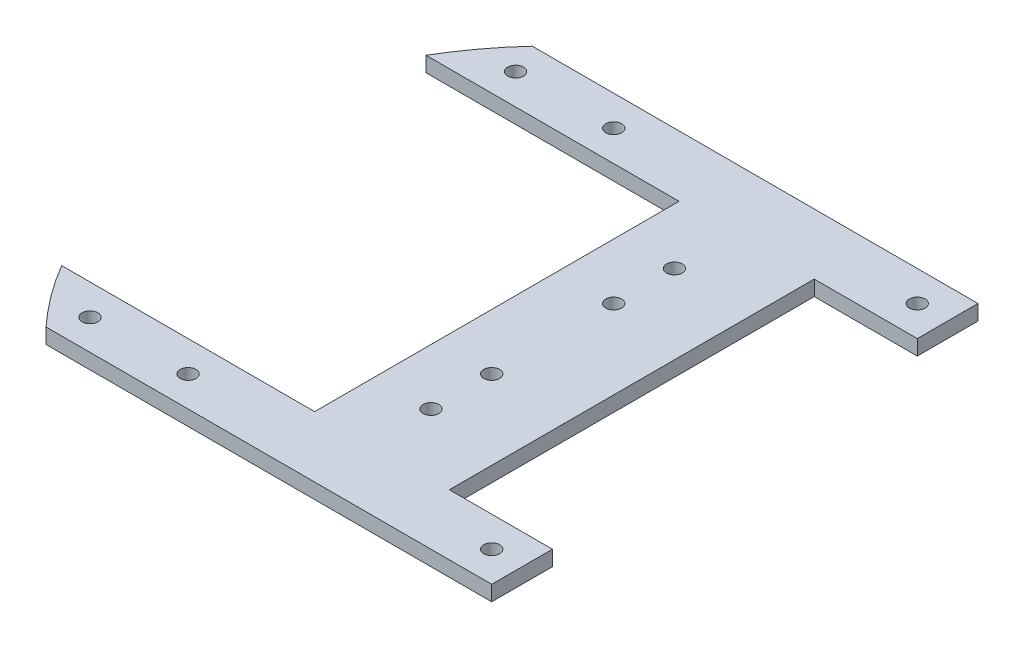
from build123d import *

# Parameters (mm, degrees)
SKETCH1_R           = 1.651
BOSS_EXTRUDE1_DEPTH = 3.175
CUT_EXTRUDE1_START  = -3.175
CUT_EXTRUDE1_DEPTH  = 3.175


with BuildPart() as part:
    # Sketch1 → Boss-Extrude1 (new body)
    with BuildSketch(Plane(origin=(0, 0, 0), x_dir=(1, 0, 0), z_dir=(0, 1, 0))):
        with BuildLine():
            Line((-73.916912814, 12.7), (-73.916912814, -12.7))
            ThreePointArc((-73.916912814, -12.7), (-67.281551776, -33.138991997), (-55.122759171, -50.857461806))
            Line((-55.122759171, -50.857461806), (55.122759171, -50.857461806))
            ThreePointArc((55.122759171, -50.857461806), (61.833234068, -42.445861574), (67.270928268, -33.160552015))
            ThreePointArc((67.270928268, -33.160552015), (47.932265908, 0), (67.270928268, 33.160552015))
            ThreePointArc((67.270928268, 33.160552015), (61.833234068, 42.445861574), (55.122759171, 50.857461806))
            Line((55.122759171, 50.857461806), (-55.122759171, 50.857461806))
            ThreePointArc((-55.122759171, 50.857461806), (-67.281551776, 33.138991997), (-73.916912814, 12.7))
        make_face()
        with Locations(Location((0, -12.757461806, 0), (0, 0, 270))):
            Circle(SKETCH1_R, mode=Mode.SUBTRACT)
        with Locations(Location((0, -25.457461806, 0), (0, 0, 270))):
            Circle(SKETCH1_R, mode=Mode.SUBTRACT)
        with Locations(Location((31.75, -44.507461806, 0), (0, 0, 270))):
            Circle(SKETCH1_R, mode=Mode.SUBTRACT)
        with Locations(Location((-31.75, -44.507461806, 0), (0, 0, 270))):
            Circle(SKETCH1_R, mode=Mode.SUBTRACT)
        with Locations(Location((-52.26766059, 44.507461806, 0), (0, 0, 270))):
            Circle(SKETCH1_R, mode=Mode.SUBTRACT)
        with Locations(Location((-52.26766059, -44.507461806, 0), (0, 0, 270))):
            Circle(SKETCH1_R, mode=Mode.SUBTRACT)
        with Locations(Location((-31.75, 44.507461806, 0), (0, 0, 270))):
            Circle(SKETCH1_R, mode=Mode.SUBTRACT)
        with Locations(Location((31.75, 44.507461806, 0), (0, 0, 270))):
            Circle(SKETCH1_R, mode=Mode.SUBTRACT)
        with Locations(Location((0, 25.457461806, 0), (0, 0, 90))):
            Circle(SKETCH1_R, mode=Mode.SUBTRACT)
        with Locations(Location((0, 12.757461806, 0), (0, 0, 90))):
            Circle(SKETCH1_R, mode=Mode.SUBTRACT)
    extrude(amount=BOSS_EXTRUDE1_DEPTH)

    # Sketch2 → Cut-Extrude1 (cut)
    with BuildSketch(Plane(origin=(0, 3.175, 0), x_dir=(1, 0, 0), z_dir=(0, 1, 0)).offset(CUT_EXTRUDE1_START)):
        with BuildLine():
            Line((38.1, -50.857461806), (38.1, -38.157461806))
            Line((38.1, -38.157461806), (16.550455454, -38.157461806))
            Line((16.550455454, -38.157461806), (16.550455454, 38.157461806))
            Line((16.550455454, 38.157461806), (38.1, 38.157461806))
            Line((38.1, 38.157461806), (38.1, 50.857461806))
            Line((38.1, 50.857461806), (55.122759171, 50.857461806))
            ThreePointArc((55.122759171, 50.857461806), (61.833234068, 42.445861574), (67.270928268, 33.160552015))
            ThreePointArc((67.270928268, 33.160552015), (47.932265908, 0), (67.270928268, -33.160552015))
            ThreePointArc((67.270928268, -33.160552015), (61.833234068, -42.445861574), (55.122759171, -50.857461806))
            Line((55.122759171, -50.857461806), (38.1, -50.857461806))
        make_face()
        with BuildLine():
            Line((-64.601780161, 38.1), (-11.686912814, 38.1))
            Line((-11.686912814, 38.1), (-11.686912814, -38.1))
            Line((-11.686912814, -38.1), (-64.601780161, -38.1))
            ThreePointArc((-64.601780161, -38.1), (-70.414111341, -25.823495582), (-73.916912814, -12.7))
            Line((-73.916912814, -12.7), (-73.916912814, 12.7))
            ThreePointArc((-73.916912814, 12.7), (-70.414111341, 25.823495582), (-64.601780161, 38.1))
        make_face()
    extrude(amount=CUT_EXTRUDE1_DEPTH, mode=Mode.SUBTRACT)


solid = part.part
